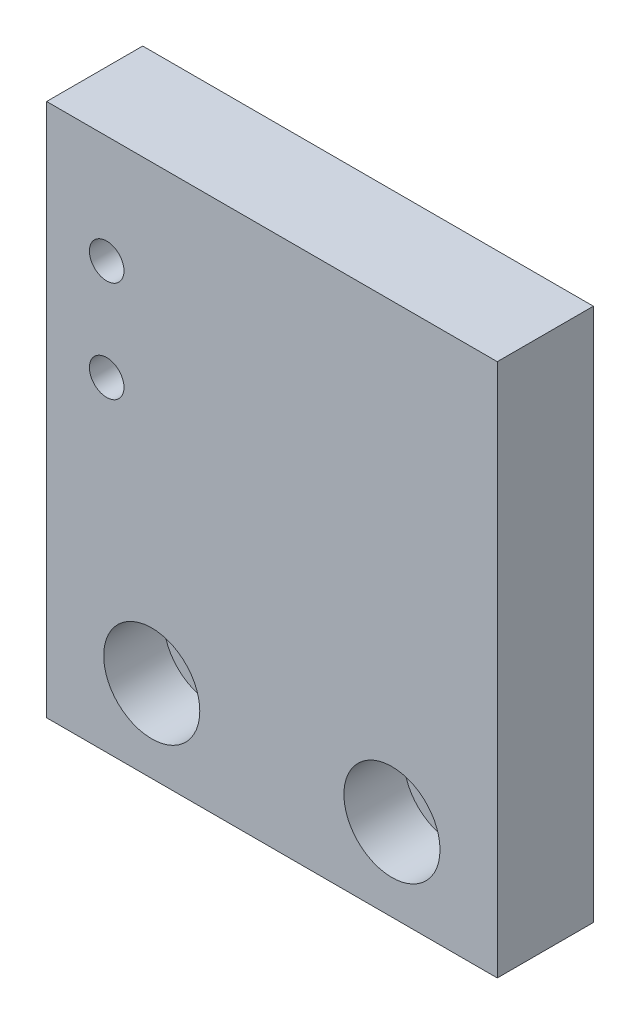
from build123d import *

# Parameters (mm, degrees)
SKETCH1_W                                        = 47.6504
SKETCH1_H                                        = 56.4388
BOSS_EXTRUDE1_DEPTH                              = 10.16
CBORE_FOR_1_4_BUTTON_HEAD_CAP_SCREW1_D           = 6.5278
CBORE_FOR_1_4_BUTTON_HEAD_CAP_SCREW1_CBORE_D     = 10.16
CBORE_FOR_1_4_BUTTON_HEAD_CAP_SCREW1_CBORE_DEPTH = 6.35
CBORE_FOR_6_SOCKET_HEAD_CAP_SCREW1_D             = 3.6576
CBORE_FOR_6_SOCKET_HEAD_CAP_SCREW1_CBORE_D       = 7.14502
CBORE_FOR_6_SOCKET_HEAD_CAP_SCREW1_CBORE_DEPTH   = 3.5052


with BuildPart() as part:
    # Sketch1 → Boss-Extrude1 (new body)
    with BuildSketch(Plane.XY):
        with Locations((23.8252, 28.2194)):
            Rectangle(SKETCH1_W, SKETCH1_H)
    extrude(amount=BOSS_EXTRUDE1_DEPTH)

    # CBORE for 1/4 Button Head Cap Screw1 (through all)
    with Locations(Plane.XY.offset(10.16)):
        with Locations((36.5125, 8.7122), (11.1125, 8.7122)):
            CounterBoreHole(CBORE_FOR_1_4_BUTTON_HEAD_CAP_SCREW1_D / 2, CBORE_FOR_1_4_BUTTON_HEAD_CAP_SCREW1_CBORE_D / 2, CBORE_FOR_1_4_BUTTON_HEAD_CAP_SCREW1_CBORE_DEPTH)

    # CBORE for #6 Socket Head Cap Screw1 (through all)
    with Locations(Plane(origin=(0, 0, 0), x_dir=(-1, 0, 0), z_dir=(0, 0, -1))):
        with Locations((-6.35, 34.3408), (-6.35, 45.0088)):
            CounterBoreHole(CBORE_FOR_6_SOCKET_HEAD_CAP_SCREW1_D / 2, CBORE_FOR_6_SOCKET_HEAD_CAP_SCREW1_CBORE_D / 2, CBORE_FOR_6_SOCKET_HEAD_CAP_SCREW1_CBORE_DEPTH)


solid = part.part
